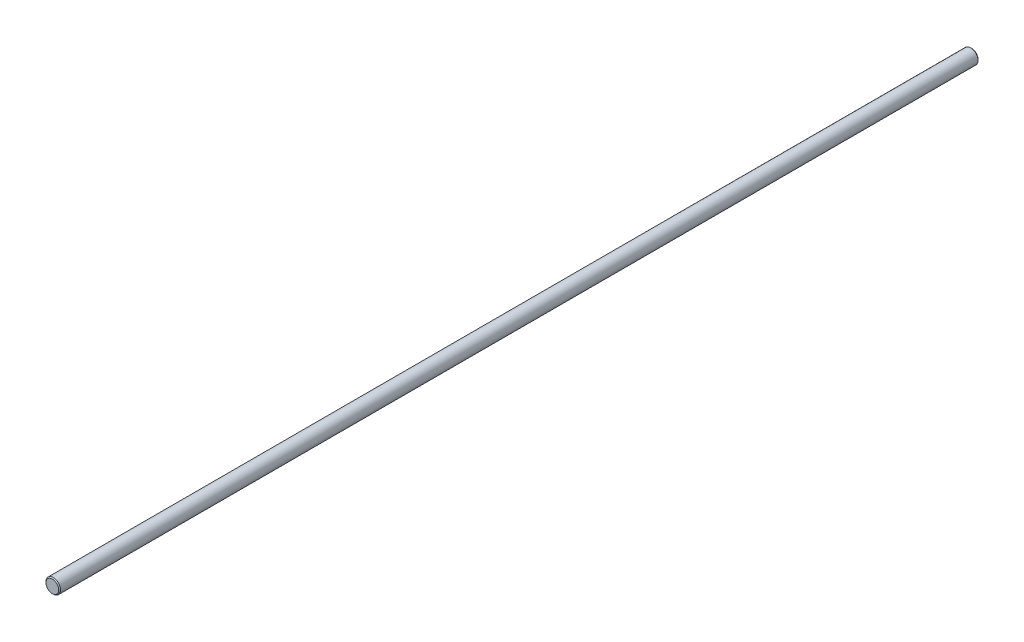
from build123d import *

# Parameters (mm, degrees)
SKETCH1_R           = 3.95
BOSS_EXTRUDE1_DEPTH = 500
CHAMFER1_SIZE       = 0.5


with BuildPart() as part:
    # Sketch1 → Boss-Extrude1 (new body)
    with BuildSketch(Plane.XY):
        Circle(SKETCH1_R)
    extrude(amount=BOSS_EXTRUDE1_DEPTH)

    # Chamfer1
    chamfer1_edges = [part.edges().sort_by_distance(p)[0] for p in [
        (-3.95, 0, 0),
        (-3.95, 0, 500),
    ]]
    chamfer(chamfer1_edges, length=CHAMFER1_SIZE)


solid = part.part
